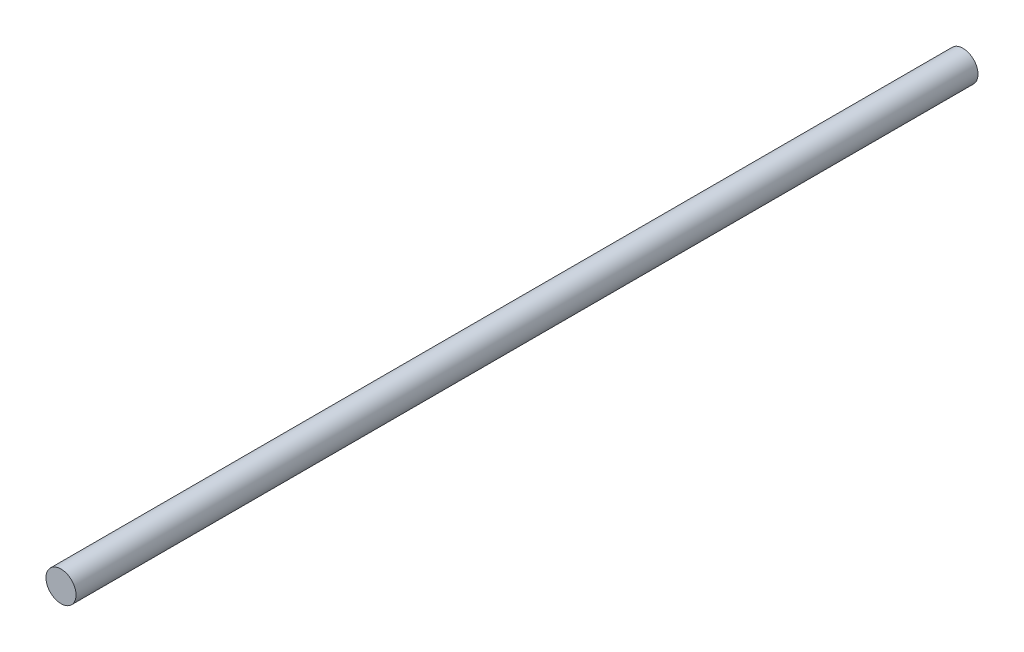
from build123d import *

# Parameters (mm, degrees)
SKETCH1_R           = 12.065
BOSS_EXTRUDE1_DEPTH = 723.9


with BuildPart() as part:
    # Sketch1 → Boss-Extrude1 (new body)
    with BuildSketch(Plane.XY):
        Circle(SKETCH1_R)
    extrude(amount=BOSS_EXTRUDE1_DEPTH)


solid = part.part
